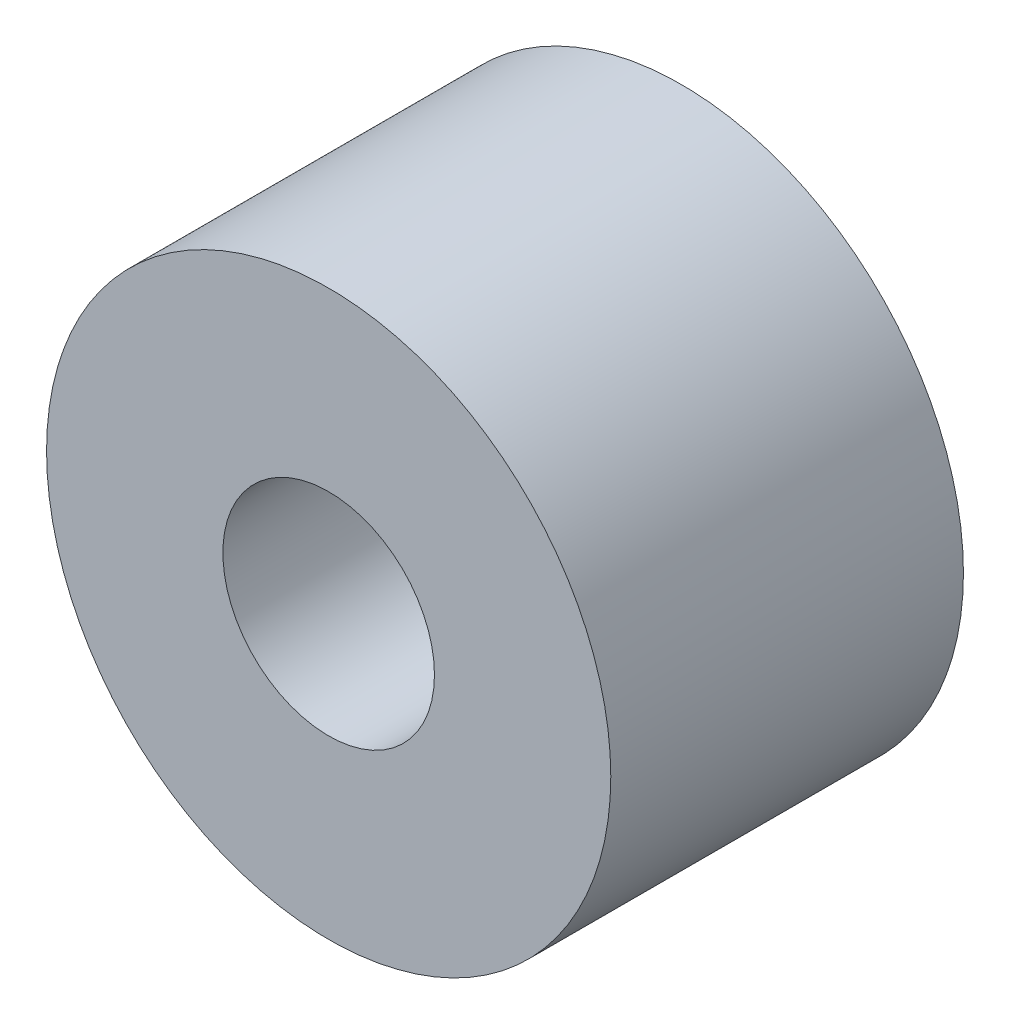
from build123d import *

# Parameters (mm, degrees)
SKETCH2_R           = 4
SKETCH2_R_2         = 1.5
BOSS_EXTRUDE1_DEPTH = 5


with BuildPart() as part:
    # Sketch2 → Boss-Extrude1 (new body)
    with BuildSketch(Plane.XY):
        Circle(SKETCH2_R)
        Circle(SKETCH2_R_2, mode=Mode.SUBTRACT)
    extrude(amount=BOSS_EXTRUDE1_DEPTH)


solid = part.part
